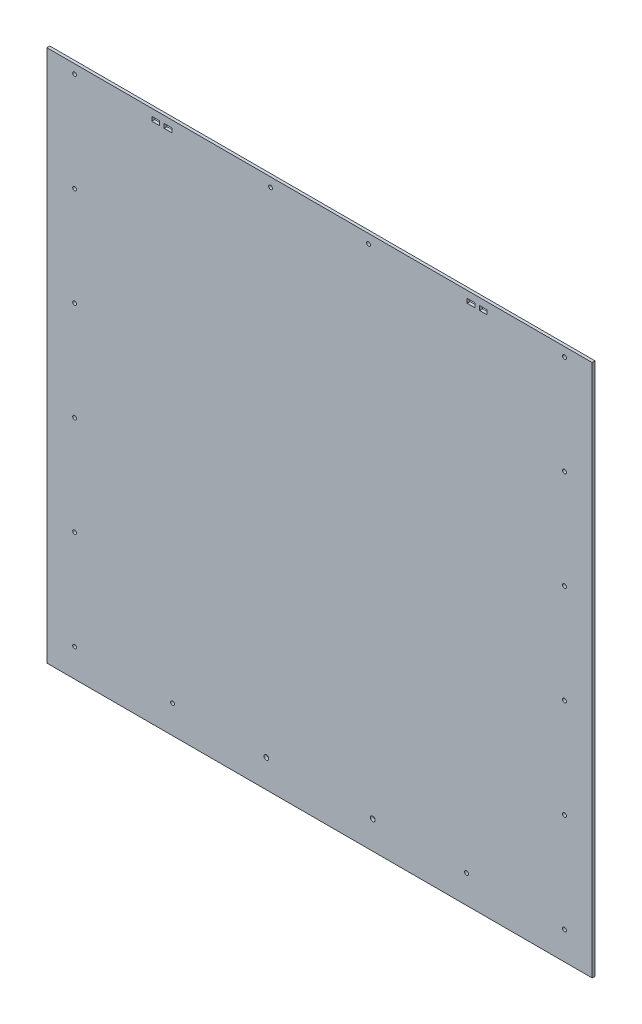
from build123d import *

# Parameters (mm, degrees)
SKETCH_1_W          = 748
SKETCH_1_H          = 731.05
EXTRUDE_1_DEPTH     = 4
SKETCH_2_W          = 10.5
SKETCH_2_H          = 5.8
CUT_EXTRUDE_1_DEPTH = 1046.922608275
SKETCH_4_R          = 3.25
CUT_EXTRUDE_2_DEPTH = 1044.130721674
SKETCH_5_R          = 2.6
CUT_EXTRUDE_3_DEPTH = 1046.922608275


with BuildPart() as part:
    # Эскиз1 → Бобышка-Вытянуть1 (new body)
    with BuildSketch(Plane.XY):
        with Locations((374, -365.525)):
            Rectangle(SKETCH_1_W, SKETCH_1_H)
    extrude(amount=EXTRUDE_1_DEPTH)

    # Эскиз2 → Вырез-Вытянуть1 (cut, through all)
    with BuildSketch(Plane.XY.offset(4)):
        with Locations((149.25, -12.47)):
            Rectangle(SKETCH_2_W, SKETCH_2_H)
        with Locations((166.25, -12.47)):
            Rectangle(SKETCH_2_W, SKETCH_2_H)
        with Locations((581.75, -12.47)):
            Rectangle(SKETCH_2_W, SKETCH_2_H)
        with Locations((598.75, -12.47)):
            Rectangle(SKETCH_2_W, SKETCH_2_H)
    extrude(amount=-CUT_EXTRUDE_1_DEPTH, mode=Mode.SUBTRACT)

    # Эскиз4 → Вырез-Вытянуть2 (cut, through all)
    with BuildSketch(Plane(origin=(0, -727.05, 4), x_dir=(1, 0, 0), z_dir=(0, 0, -1))):
        with Locations(Location((301, -34.58, 0), (0, 0, 180))):
            Circle(SKETCH_4_R)
        with Locations(Location((447, -34.58, 0), (0, 0, 180))):
            Circle(SKETCH_4_R)
    extrude(amount=CUT_EXTRUDE_2_DEPTH, mode=Mode.SUBTRACT)

    # Эскиз5 → Вырез-Вытянуть3 (cut, through all)
    with BuildSketch(Plane(origin=(0, 0, 0), x_dir=(-1, 0, 0), z_dir=(0, 0, -1))):
        with Locations((-710, -12.47)):
            Circle(SKETCH_5_R)
        with Locations((-441.2, -12.47)):
            Circle(SKETCH_5_R)
        with Locations((-306.8, -12.47)):
            Circle(SKETCH_5_R)
        with Locations((-38, -12.47)):
            Circle(SKETCH_5_R)
        with Locations((-710, -148.47)):
            Circle(SKETCH_5_R)
        with Locations((-710, -284.47)):
            Circle(SKETCH_5_R)
        with Locations((-710, -420.47)):
            Circle(SKETCH_5_R)
        with Locations((-710, -556.47)):
            Circle(SKETCH_5_R)
        with Locations((-710, -692.47)):
            Circle(SKETCH_5_R)
        with Locations((-575.6, -692.47)):
            Circle(SKETCH_5_R)
        with Locations((-172.4, -692.47)):
            Circle(SKETCH_5_R)
        with Locations((-38, -148.47)):
            Circle(SKETCH_5_R)
        with Locations((-38, -284.47)):
            Circle(SKETCH_5_R)
        with Locations((-38, -420.47)):
            Circle(SKETCH_5_R)
        with Locations((-38, -556.47)):
            Circle(SKETCH_5_R)
        with Locations((-38, -692.47)):
            Circle(SKETCH_5_R)
    extrude(amount=-CUT_EXTRUDE_3_DEPTH, mode=Mode.SUBTRACT)


solid = part.part
